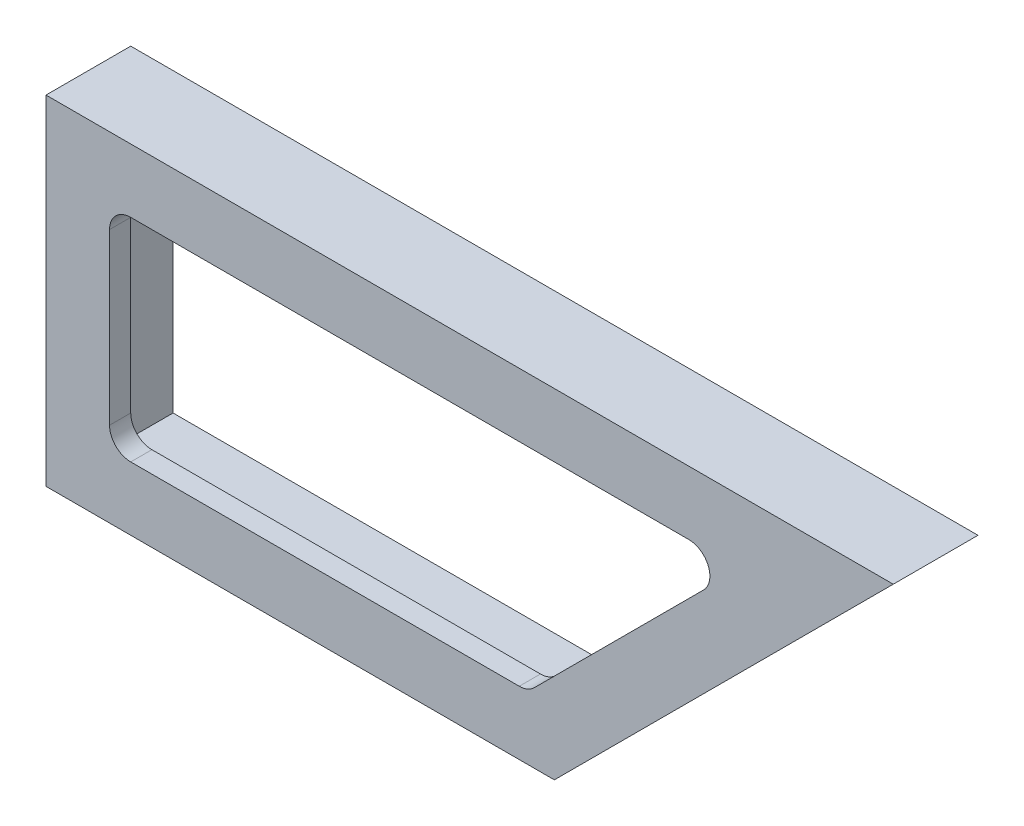
from build123d import *

# Parameters (mm, degrees)
BOSS_EXTRUDE1_DEPTH = 2
CUT_EXTRUDE1_DEPTH  = 1.5
CUT_EXTRUDE2_DEPTH  = 15.560219779
FILLET1_R           = 0.5


with BuildPart() as part:
    # Sketch1 → Boss-Extrude1 (new body)
    with BuildSketch(Plane.XY):
        Polygon((0, 0), (8, 8), (0, 8), (-12, 8), (-12, 0), align=None)
    extrude(amount=BOSS_EXTRUDE1_DEPTH)

    # Sketch2 → Cut-Extrude1 (cut)
    with BuildSketch(Plane(origin=(0, 0, 0), x_dir=(-1, 0, 0), z_dir=(0, 0, -1))):
        Polygon((0.414213562, 7), (-5.585786438, 7), (0.414213562, 1), (11, 1), (11, 7), align=None)
    extrude(amount=-CUT_EXTRUDE1_DEPTH, mode=Mode.SUBTRACT)

    # Sketch3 → Cut-Extrude2 (cut, through all)
    with BuildSketch(Plane.XY.offset(2)):
        Polygon((0, 6.5), (4.378679656, 6.5), (-0.621320344, 1.5), (-10.5, 1.5), (-10.5, 6.5), align=None)
    extrude(amount=-CUT_EXTRUDE2_DEPTH, mode=Mode.SUBTRACT)

    # Fillet1
    fillet1_edges = [part.edges().sort_by_distance(p)[0] for p in [
        (-10.5, 1.5, 1.75),
        (-10.5, 6.5, 1.75),
        (4.378679656, 6.5, 1.75),
        (-0.621320344, 1.5, 1.75),
    ]]
    fillet(fillet1_edges, radius=FILLET1_R)


solid = part.part
